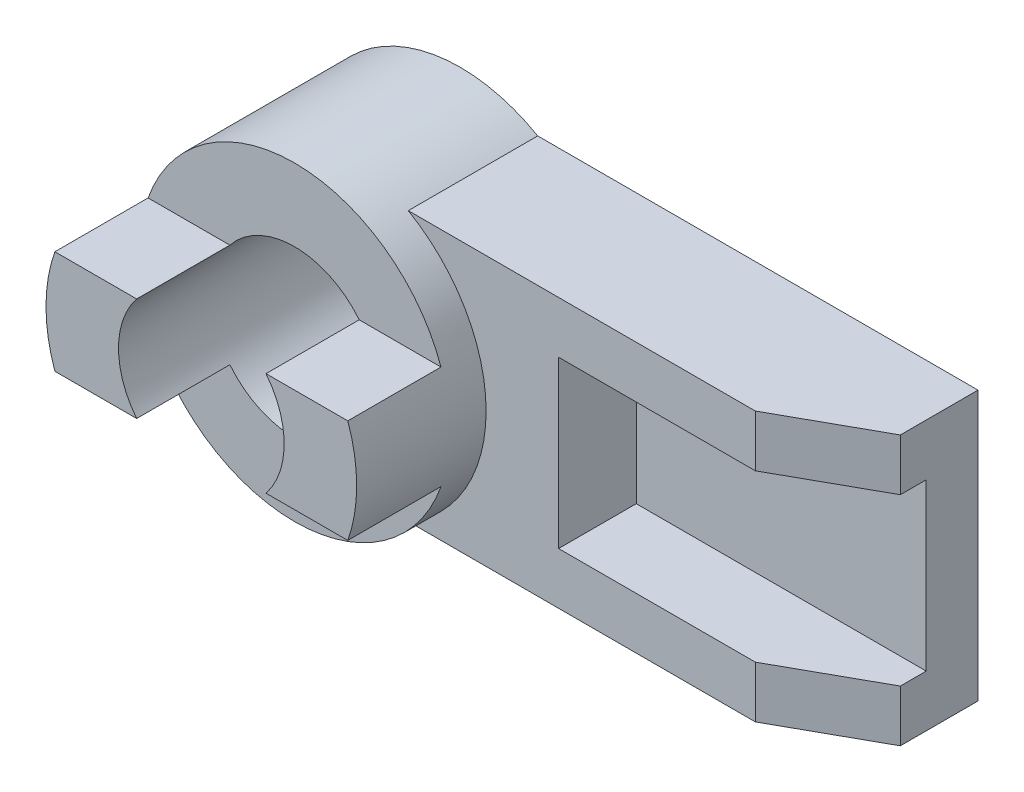
from build123d import *

# Parameters (mm, degrees)
SKETCH1_W           = 100
SKETCH1_H           = 52
BOSS_EXTRUDE1_DEPTH = 25
SKETCH2_R           = 30
BOSS_EXTRUDE2_DEPTH = 50
CUT_EXTRUDE1_REACH  = 127.044
SKETCH4_W           = 56
SKETCH4_H           = 32
CUT_EXTRUDE2_DEPTH  = 15
SKETCH5_OUTSIDE_W   = 162.332
SKETCH5_OUTSIDE_H   = 92.332
SKETCH5_OUTSIDE_W_2 = 73.851546866
SKETCH5_OUTSIDE_H_2 = 20
CUT_EXTRUDE3_DEPTH  = 18
CUT_EXTRUDE4_REACH  = 127.044
SKETCH6_R           = 16


with BuildPart() as part:
    # Sketch1 → Boss-Extrude1 (new body)
    with BuildSketch(Plane.XY):
        with Locations((50, 26)):
            Rectangle(SKETCH1_W, SKETCH1_H)
    extrude(amount=BOSS_EXTRUDE1_DEPTH)

    # Sketch2 → Boss-Extrude2 (add)
    with BuildSketch(Plane(origin=(0, 0, 0), x_dir=(-1, 0, 0), z_dir=(0, 0, -1))):
        with Locations((0, 26)):
            Circle(SKETCH2_R)
    extrude(amount=-BOSS_EXTRUDE2_DEPTH)

    # Sketch3 → Cut-Extrude1 (cut, up to next)
    with BuildSketch(Plane(origin=(0, 52, 0), x_dir=(1, 0, 0), z_dir=(0, 1, 0)), mode=Mode.PRIVATE) as cut_extrude1_sk1:
        Polygon((100, -25), (100, -15), (82, -25), align=None)
    cut_extrude1_tool1 = extrude(cut_extrude1_sk1.sketch, amount=-CUT_EXTRUDE1_REACH, mode=Mode.PRIVATE) & part.part
    add(cut_extrude1_tool1.solids().sort_by_distance((94, 52, 21.666667))[0], mode=Mode.SUBTRACT)

    # Sketch4 → Cut-Extrude2 (cut)
    with BuildSketch(Plane.XY.offset(25)):
        with Locations((72, 26)):
            Rectangle(SKETCH4_W, SKETCH4_H)
    extrude(amount=-CUT_EXTRUDE2_DEPTH, mode=Mode.SUBTRACT)

    # Sketch5 outside → Cut-Extrude3 (cut)
    with BuildSketch(Plane.XY.offset(50)):
        with Locations((35, 26)):
            Rectangle(SKETCH5_OUTSIDE_W, SKETCH5_OUTSIDE_H)
        with Locations((0, 26)):
            Rectangle(SKETCH5_OUTSIDE_W_2, SKETCH5_OUTSIDE_H_2, mode=Mode.SUBTRACT)
    extrude(amount=-CUT_EXTRUDE3_DEPTH, mode=Mode.SUBTRACT)

    # Sketch6 → Cut-Extrude4 (cut, up to next)
    with BuildSketch(Plane.XY.offset(50), mode=Mode.PRIVATE) as cut_extrude4_sk1:
        with Locations(Location((0, 26, 0), (0, 0, 38.682187453))):
            Circle(SKETCH6_R)
    cut_extrude4_tool1 = extrude(cut_extrude4_sk1.sketch, amount=-CUT_EXTRUDE4_REACH, mode=Mode.PRIVATE) & part.part
    add(cut_extrude4_tool1.solids().sort_by_distance((0, 26, 50))[0], mode=Mode.SUBTRACT)


solid = part.part
